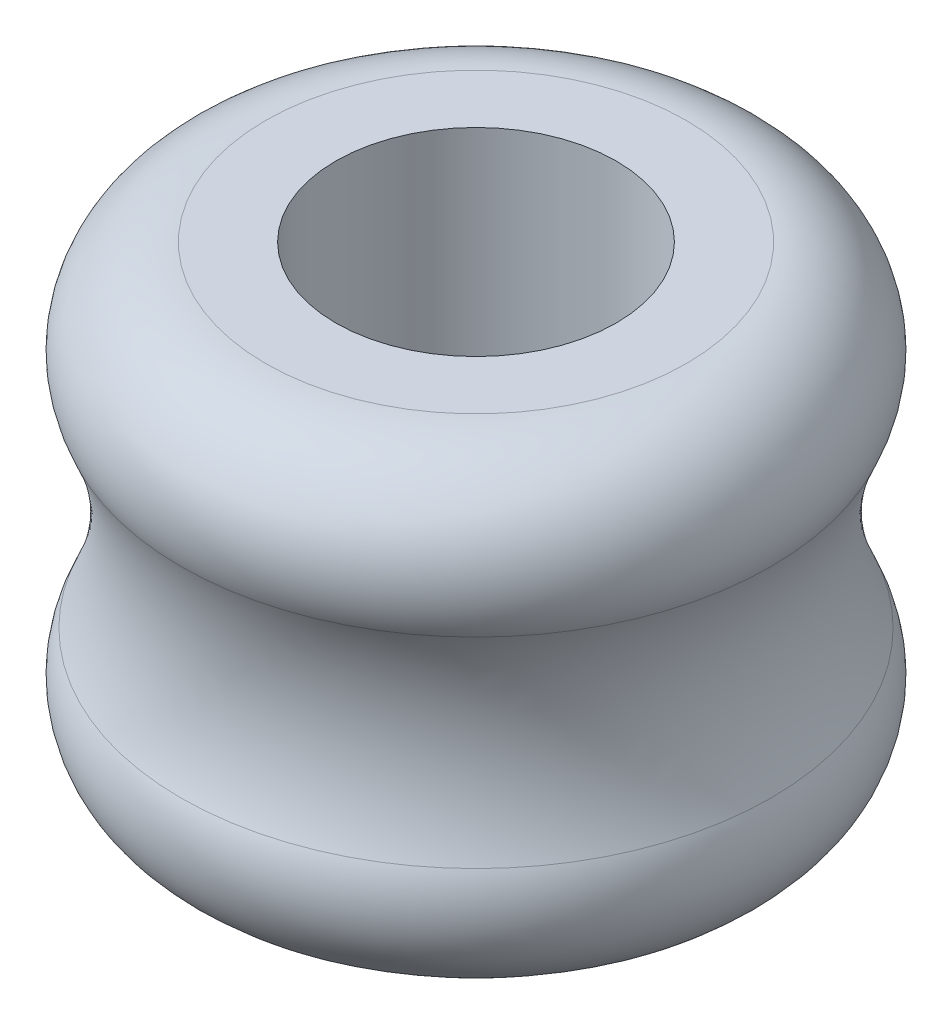
from build123d import *

# Parameters (mm, degrees)
ESBO_O2_R             = 3
CORTE_EXTRUS_O1_DEPTH = 14.583077877


with BuildPart() as part:
    # Esboço1 → Revolução1 (revolve)
    with BuildSketch(Plane.XY):
        with BuildLine():
            Line((0, 0), (-4.5, 0))
            ThreePointArc((-4.5, 0), (-6.190308509, 0.930955032), (-6.307015806, 2.857142857))
            ThreePointArc((-6.307015806, 2.857142857), (-5.82455532, 5), (-6.307015806, 7.142857143))
            ThreePointArc((-6.307015806, 7.142857143), (-6.190308509, 9.069044968), (-4.5, 10))
            Line((-4.5, 10), (0, 10))
            Line((0, 10), (0, 0))
        make_face()
    revolve(axis=Axis((0, 10, 0), (0, -1, 0)))

    # Esboço2 → Corte-extrusão1 (cut, through all)
    with BuildSketch(Plane.XZ):
        Circle(ESBO_O2_R)
    extrude(amount=-CORTE_EXTRUS_O1_DEPTH, mode=Mode.SUBTRACT)


solid = part.part
